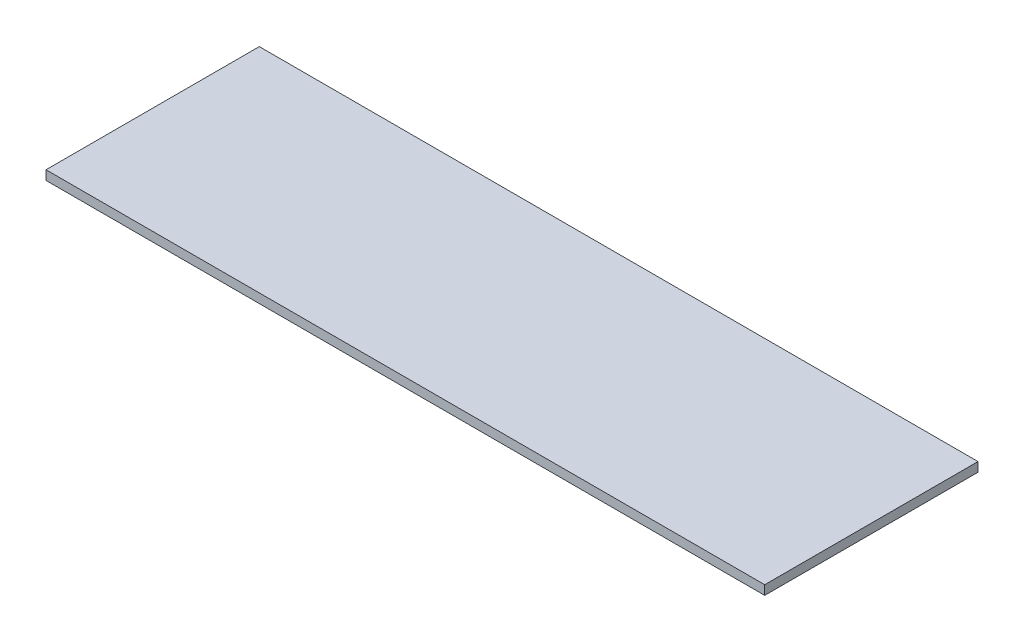
from build123d import *

# Parameters (mm, degrees)
SKETCH1_W           = 155
SKETCH1_H           = 46
BOSS_EXTRUDE1_DEPTH = 2


with BuildPart() as part:
    # Sketch1 → Boss-Extrude1 (new body)
    with BuildSketch(Plane(origin=(0, 0, 0), x_dir=(1, 0, 0), z_dir=(0, 1, 0))):
        Rectangle(SKETCH1_W, SKETCH1_H)
    extrude(amount=BOSS_EXTRUDE1_DEPTH)


solid = part.part
